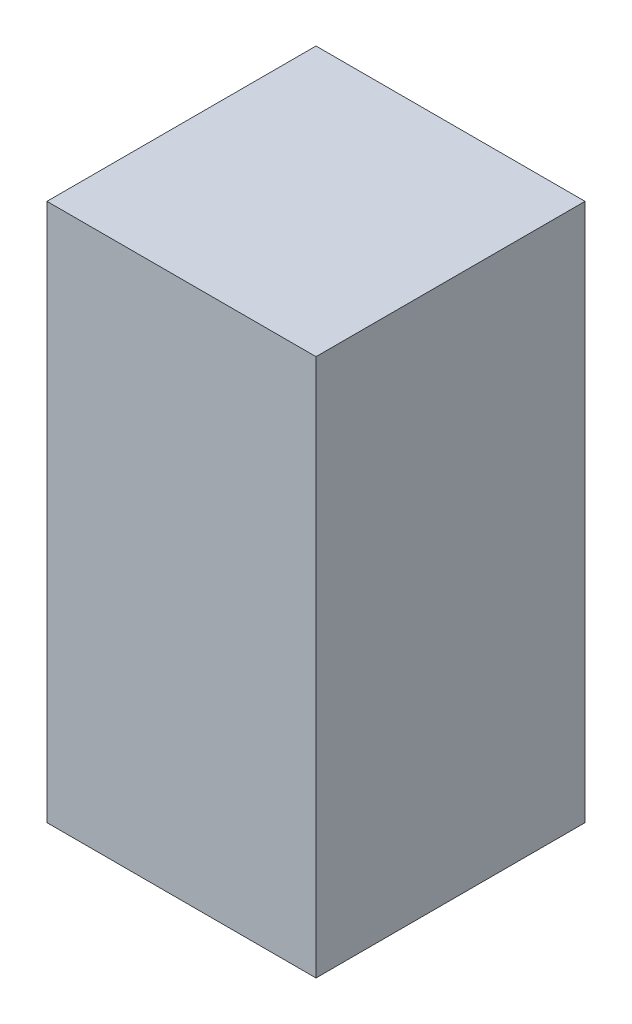
from build123d import *

# Parameters (mm, degrees)
SKETCH_1_W      = 20
SKETCH_1_H      = 20
EXTRUDE_1_DEPTH = 40


with BuildPart() as part:
    # 草图1 → 凸台-拉伸1 (new body)
    with BuildSketch(Plane(origin=(0, 0, 0), x_dir=(1, 0, 0), z_dir=(0, 1, 0))):
        Rectangle(SKETCH_1_W, SKETCH_1_H)
    extrude(amount=EXTRUDE_1_DEPTH)


solid = part.part
